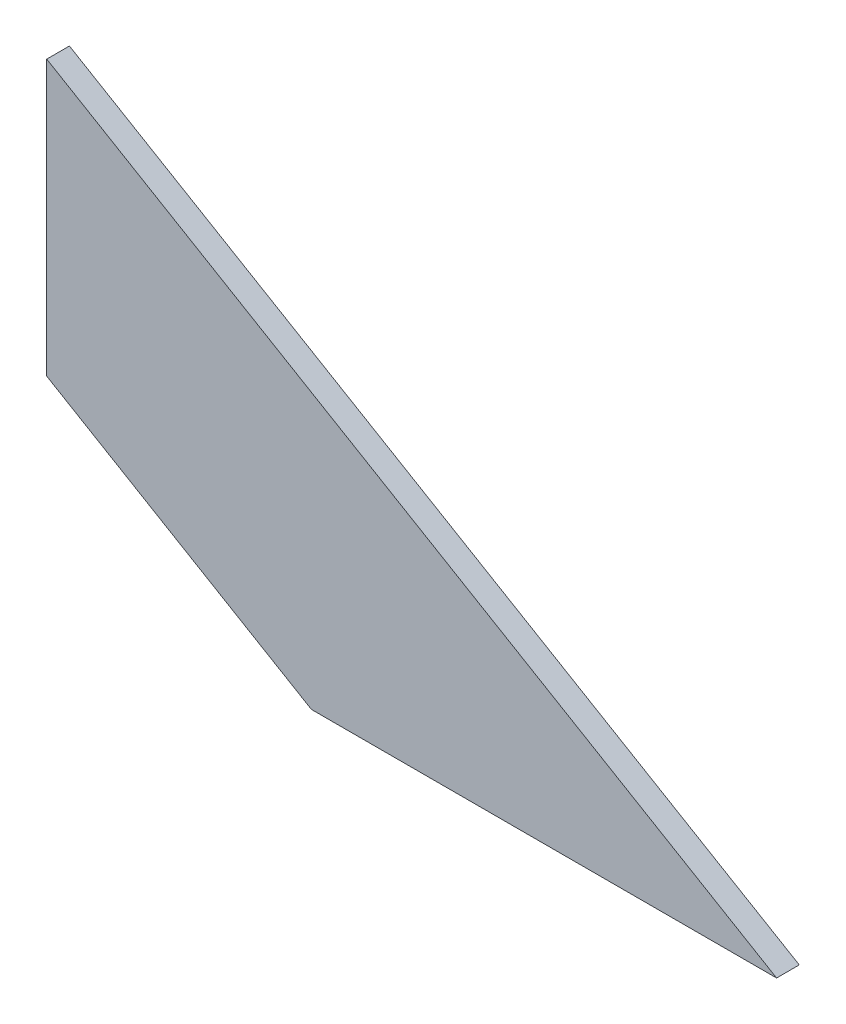
from build123d import *

# Parameters (mm, degrees)
BOSS_EXTRUDE2_DEPTH = 2


with BuildPart() as part:
    # Sketch1 → Boss-Extrude2 (new body)
    with BuildSketch(Plane.XY):
        Polygon((128.754910615, 231.046078464), (193.123210615, 193.046078464), (152.098334087, 193.046078464), (128.754910615, 206.826931647), align=None)
    extrude(amount=BOSS_EXTRUDE2_DEPTH)


solid = part.part
